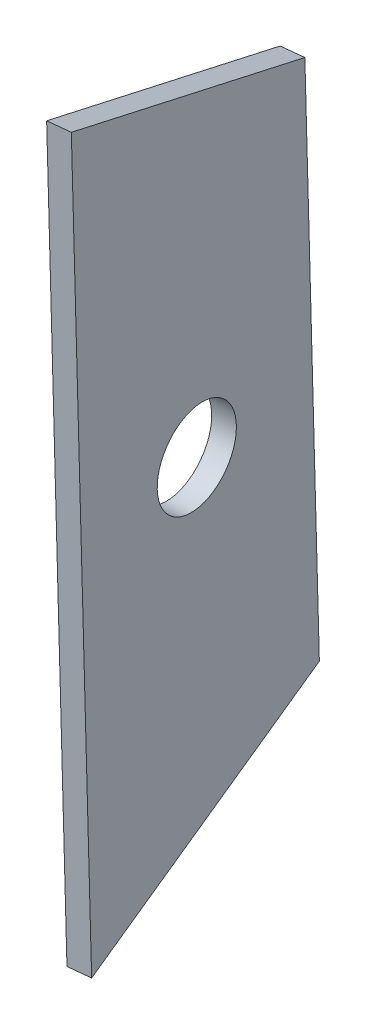
from build123d import *

# Parameters (mm, degrees)
SKETCH1_R           = 3.2639
BOSS_EXTRUDE1_DEPTH = 1.5875


with BuildPart() as part:
    # Sketch1 → Boss-Extrude1 (new body)
    with BuildSketch(Plane(origin=(368.936903679, -5.383850256, -45.587186199), x_dir=(-0.12260510858720207, 0.001789161069619477, -0.9924539214749405), z_dir=(0.9923482658198145, -0.014481214569019532, -0.12261816239453538))):
        Polygon((411.594066589, 245.557996517), (414.180881556, 191.185032904), (432.797343041, 200.517860894), (430.950777657, 239.331318274), align=None)
        with Locations(Location((422.380767211, 219.148052147, 0), (0, 0, 359.897477817))):
            Circle(SKETCH1_R, mode=Mode.SUBTRACT)
    extrude(amount=BOSS_EXTRUDE1_DEPTH)


solid = part.part
